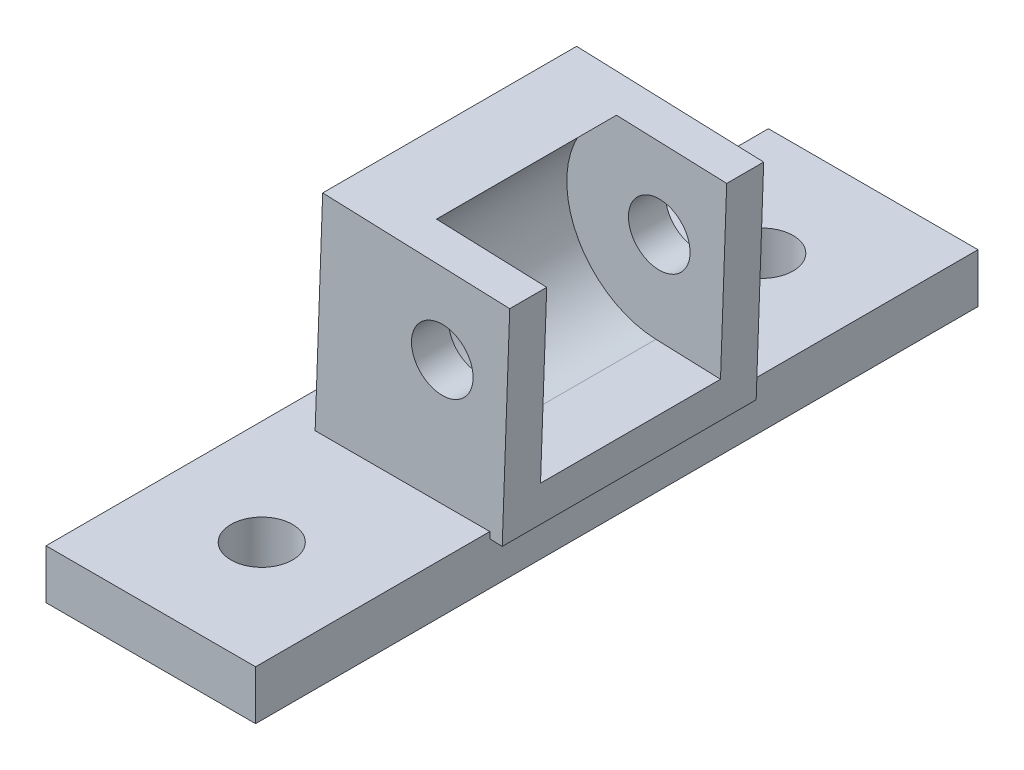
from build123d import *

# Parameters (mm, degrees)
BOSS_EXTRUDE1_DEPTH = 22.352
BOSS_EXTRUDE3_START = -3.81
SKETCH2_R           = 3.175
BOSS_EXTRUDE3_DEPTH = 3.81
BOSS_EXTRUDE4_DEPTH = 3.81
CUT_EXTRUDE1_START  = -3.81
SKETCH6_R           = 3.175
CUT_EXTRUDE1_DEPTH  = 3.81
SKETCH7_W           = 21.59
SKETCH7_H           = 74.422
BOSS_EXTRUDE6_DEPTH = 5.08
SKETCH9_R           = 3.175
CUT_EXTRUDE2_DEPTH  = 6.35


with BuildPart() as part:
    # Sketch1 → Boss-Extrude1 (new body)
    with BuildSketch(Plane.XY):
        with BuildLine():
            ThreePointArc((-352.162161707, 117.383467749), (-351.384007065, 117.9545664), (-350.552048848, 118.44397813))
            Line((-350.552048848, 118.44397813), (-358.467972096, 118.728192663))
            Line((-358.467972096, 118.728192663), (-359.243555017, 97.126711503))
            Line((-359.243555017, 97.126711503), (-339.97264358, 96.434805718))
            Line((-339.97264358, 96.434805718), (-339.835936837, 100.242352338))
            Line((-339.835936837, 100.242352338), (-346.486451601, 100.481133449))
            ThreePointArc((-346.486451601, 100.481133449), (-349.816499797, 101.211177598), (-352.67617906, 103.067092457))
            ThreePointArc((-352.67617906, 103.067092457), (-355.663551295, 110.341766857), (-352.162161707, 117.383467749))
        make_face()
    extrude(amount=-BOSS_EXTRUDE1_DEPTH)

    # Sketch2 → Boss-Extrude3 (add)
    with BuildSketch(Plane(origin=(0, 0, -22.352), x_dir=(-1, 0, 0), z_dir=(0, 0, -1)).offset(BOSS_EXTRUDE3_START)):
        with BuildLine():
            ThreePointArc((346.486451601, 100.481133449), (355.434706729, 107.897354875), (350.552048848, 118.44397813))
            Line((350.552048848, 118.44397813), (339.197060659, 118.036286878))
            Line((339.197060659, 118.036286878), (339.835936837, 100.242352338))
            Line((339.835936837, 100.242352338), (346.486451601, 100.481133449))
        make_face()
        with Locations((346.144684744, 110)):
            Circle(SKETCH2_R, mode=Mode.SUBTRACT)
    extrude(amount=BOSS_EXTRUDE3_DEPTH)

    # Sketch3 → Boss-Extrude4 (add)
    with BuildSketch(Plane.XY):
        Polygon((-358.467972096, 118.728192663), (-359.243555017, 97.126711503), (-339.97264358, 96.434805718), (-339.197060659, 118.036286878), align=None)
    extrude(amount=BOSS_EXTRUDE4_DEPTH)

    # Sketch6 → Cut-Extrude1 (cut)
    with BuildSketch(Plane(origin=(0, 0, 0), x_dir=(-1, 0, 0), z_dir=(0, 0, -1)).offset(CUT_EXTRUDE1_START)):
        with Locations((346.144684744, 110)):
            Circle(SKETCH6_R)
    extrude(amount=CUT_EXTRUDE1_DEPTH, mode=Mode.SUBTRACT)

    # Sketch7 → Boss-Extrude6 (add)
    with BuildSketch(Plane(origin=(0, 97.126711503, 0), x_dir=(1, 0, 0), z_dir=(0, 1, 0))):
        with Locations((-352.044558269, 9.271)):
            Rectangle(SKETCH7_W, SKETCH7_H)
    extrude(amount=-BOSS_EXTRUDE6_DEPTH)

    # Sketch9 → Cut-Extrude2 (cut)
    with BuildSketch(Plane(origin=(0, 97.126711503, 0), x_dir=(1, 0, 0), z_dir=(0, 1, 0))):
        with Locations(Location((-352.044558269, -16.51, 0), (0, 0, 270))):
            Circle(SKETCH9_R)
        with Locations(Location((-352.044558269, 35.052, 0), (0, 0, 270))):
            Circle(SKETCH9_R)
    extrude(amount=-CUT_EXTRUDE2_DEPTH, mode=Mode.SUBTRACT)


solid = part.part
